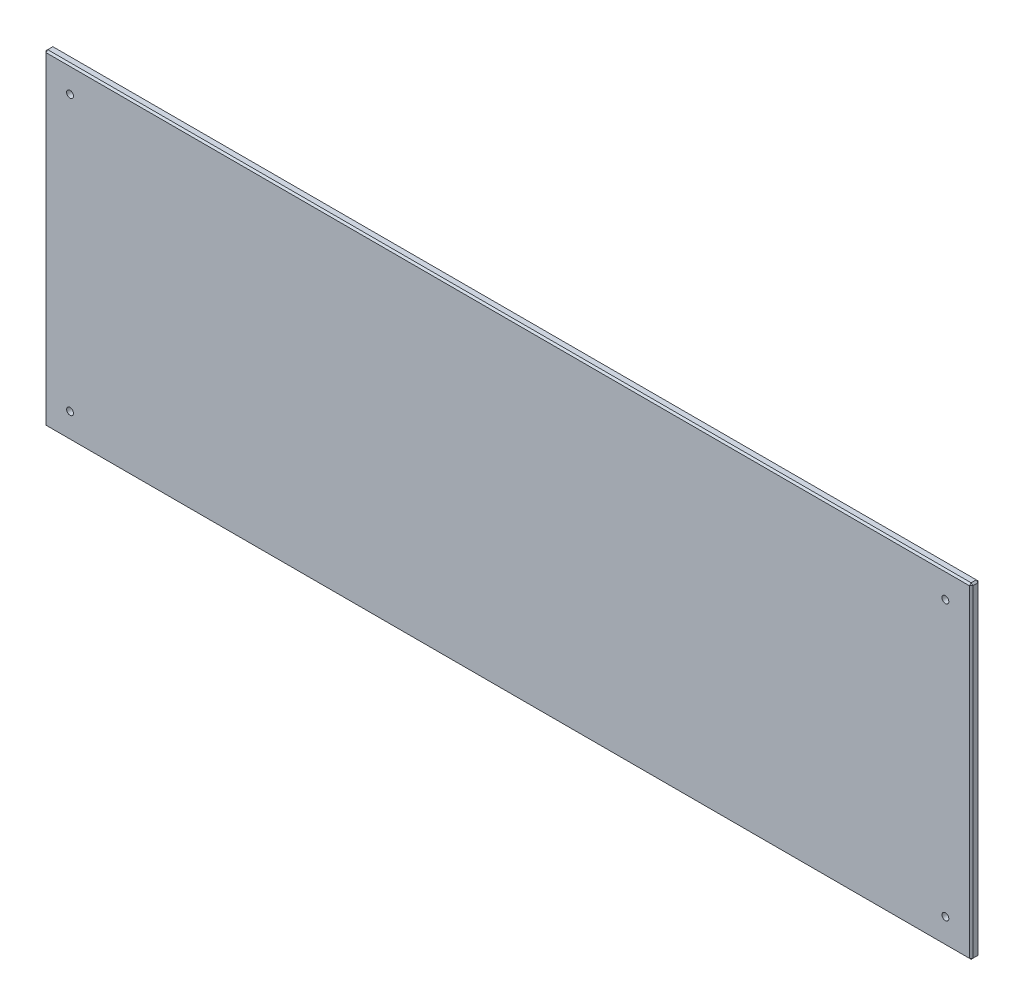
from build123d import *

# Parameters (mm, degrees)
SKETCH1_W           = 540
SKETCH1_H           = 190
BOSS_EXTRUDE1_DEPTH = 5
CHAMFER1_SIZE       = 1
SKETCH2_R           = 2
CUT_EXTRUDE1_DEPTH  = 5


with BuildPart() as part:
    # Sketch1 → Boss-Extrude1 (new body)
    with BuildSketch(Plane.XY):
        with Locations((270, 95)):
            Rectangle(SKETCH1_W, SKETCH1_H)
    extrude(amount=BOSS_EXTRUDE1_DEPTH)

    # Chamfer1
    chamfer1_edges = [part.edges().sort_by_distance(p)[0] for p in [
        (540, 95, 5),
        (270, 190, 5),
        (0, 95, 5),
        (270, 190, 0),
        (540, 95, 0),
        (270, 0, 0),
        (0, 95, 0),
        (0, 190, 2.5),
        (540, 190, 2.5),
        (540, 0, 2.5),
        (0, 0, 2.5),
        (270, 0, 5),
    ]]
    chamfer(chamfer1_edges, length=CHAMFER1_SIZE)

    # Sketch2 → Cut-Extrude1 (cut)
    with BuildSketch(Plane.XY.offset(5)):
        with Locations((525, 175)):
            Circle(SKETCH2_R)
        with Locations((525, 15)):
            Circle(SKETCH2_R)
        with Locations((15, 175)):
            Circle(SKETCH2_R)
        with Locations((15, 15)):
            Circle(SKETCH2_R)
    extrude(amount=-CUT_EXTRUDE1_DEPTH, mode=Mode.SUBTRACT)


solid = part.part
